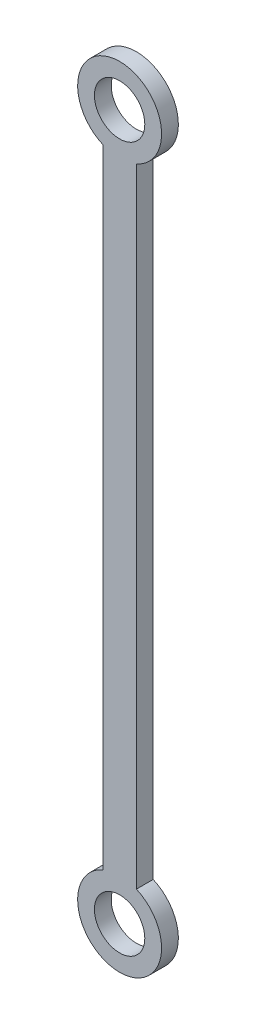
from build123d import *

# Parameters (mm, degrees)
ESQUISSE1_R        = 15
BOSS_EXTRU_1_DEPTH = 10


with BuildPart() as part:
    # Esquisse1 → Boss.-Extru.1 (new body)
    with BuildSketch(Plane.XY):
        with BuildLine():
            Line((-10, 397.087121525), (-10, 22.912878475))
            ThreePointArc((-10, 22.912878475), (0, -25), (10, 22.912878475))
            Line((10, 22.912878475), (10, 397.087121525))
            ThreePointArc((10, 397.087121525), (0, 445), (-10, 397.087121525))
        make_face()
        Circle(ESQUISSE1_R, mode=Mode.SUBTRACT)
        with Locations((0, 420)):
            Circle(ESQUISSE1_R, mode=Mode.SUBTRACT)
    extrude(amount=BOSS_EXTRU_1_DEPTH)


solid = part.part
